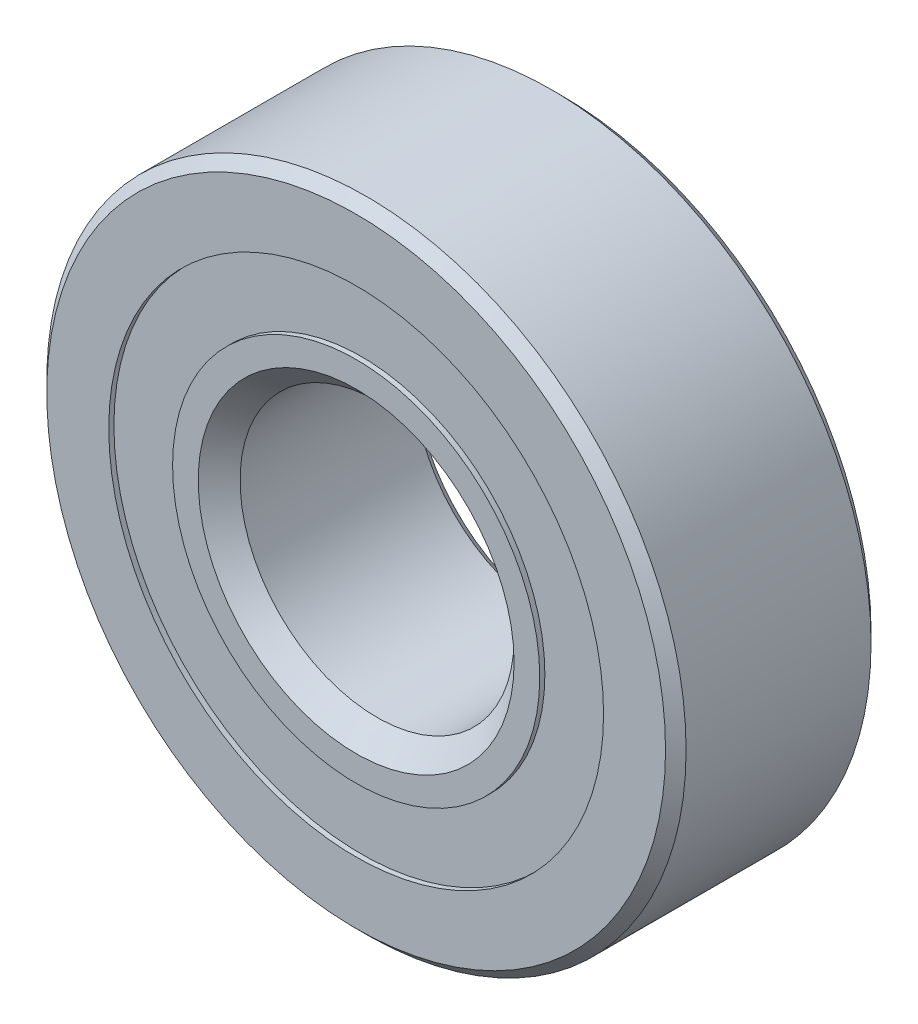
from build123d import *

# Parameters (mm, degrees)
CIRPATTERN1_COUNT = 12
SKETCH5_W         = 1.672929924
SKETCH5_H         = 2.218205964


with BuildPart() as part:
    # Sketch1 → Revolve1 (revolve)
    with BuildSketch(Plane(origin=(0, 0, 0), x_dir=(0, 0, -1), z_dir=(1, 0, 0)), mode=Mode.PRIVATE) as revolve1_sk:
        with BuildLine():
            Line((3.2146875, 11.1125), (-3.2146875, 11.1125))
            Line((-3.2146875, 11.1125), (-3.571875, 10.7553125))
            Line((-3.571875, 10.7553125), (-3.571875, 8.600412088))
            Line((-3.571875, 8.600412088), (-1.5875, 8.600412088))
            ThreePointArc((-1.5875, 8.600412088), (0, 9.657851326), (1.5875, 8.600412088))
            Line((1.5875, 8.600412088), (3.571875, 8.600412088))
            Line((3.571875, 8.600412088), (3.571875, 10.7553125))
            Line((3.571875, 10.7553125), (3.2146875, 11.1125))
        make_face()
    revolve(revolve1_sk.sketch.rotate(Axis((0, 0, 3.571875), (0, 0, -1)), 90), axis=Axis((0, 0, 3.571875), (0, 0, -1)))


with BuildPart() as body_2:
    # Sketch3 → Revolve3 (revolve)
    with BuildSketch(Plane(origin=(0, 0, 0), x_dir=(0, 0, -1), z_dir=(1, 0, 0)), mode=Mode.PRIVATE) as revolve3_sk:
        with BuildLine():
            Line((-3.39328125, 6.203612374), (-2.679493212, 5.489824337))
            Line((-2.679493212, 5.489824337), (0, 5.489824337))
            Line((0, 5.489824337), (0, 6.217148674))
            ThreePointArc((0, 6.217148674), (0.95372087, 6.505709098), (1.5875, 7.274587912))
            Line((1.5875, 7.274587912), (3.571875, 7.274587912))
            Line((3.571875, 7.274587912), (3.571875, 5.1196875))
            Line((3.571875, 5.1196875), (3.2146875, 4.7625))
            Line((3.2146875, 4.7625), (-2.844550663, 4.7625))
            Line((-2.844550663, 4.7625), (-3.571875, 5.489824337))
            Line((-3.571875, 5.489824337), (-3.571875, 6.382206124))
            Line((-3.571875, 6.382206124), (-3.39328125, 6.382206124))
            Line((-3.39328125, 6.382206124), (-3.39328125, 6.203612374))
        make_face()
    revolve(revolve3_sk.sketch.rotate(Axis((0, 0, 3.571875), (0, 0, -1)), 90), axis=Axis((0, 0, 3.571875), (0, 0, -1)))


with BuildPart() as body_3:
    # Sketch4 → Revolve4 (revolve)
    with BuildSketch(Plane(origin=(0, 0, 0), x_dir=(0, 0, -1), z_dir=(1, 0, 0))):
        with BuildLine():
            Line((-1.720351326, 7.9375), (1.720351326, 7.9375))
            ThreePointArc((1.720351326, 7.9375), (0, 9.657851326), (-1.720351326, 7.9375))
        make_face()
    revolve(axis=Axis((0, 7.9375, 1.720351326), (0, 0, -1)))


with BuildPart() as cirpattern1_1:
    # CirPattern1: pattern copy
    add(body_3.part.rotate(Axis((0, 0, 0), (0, 0, 1)), 1 * 360 / CIRPATTERN1_COUNT))


with BuildPart() as cirpattern1_2:
    # CirPattern1: pattern copy
    add(body_3.part.rotate(Axis((0, 0, 0), (0, 0, 1)), 2 * 360 / CIRPATTERN1_COUNT))


with BuildPart() as cirpattern1_3:
    # CirPattern1: pattern copy
    add(body_3.part.rotate(Axis((0, 0, 0), (0, 0, 1)), 3 * 360 / CIRPATTERN1_COUNT))


with BuildPart() as cirpattern1_4:
    # CirPattern1: pattern copy
    add(body_3.part.rotate(Axis((0, 0, 0), (0, 0, 1)), 4 * 360 / CIRPATTERN1_COUNT))


with BuildPart() as cirpattern1_5:
    # CirPattern1: pattern copy
    add(body_3.part.rotate(Axis((0, 0, 0), (0, 0, 1)), 5 * 360 / CIRPATTERN1_COUNT))


with BuildPart() as cirpattern1_6:
    # CirPattern1: pattern copy
    add(body_3.part.rotate(Axis((0, 0, 0), (0, 0, 1)), 6 * 360 / CIRPATTERN1_COUNT))


with BuildPart() as cirpattern1_7:
    # CirPattern1: pattern copy
    add(body_3.part.rotate(Axis((0, 0, 0), (0, 0, 1)), 7 * 360 / CIRPATTERN1_COUNT))


with BuildPart() as cirpattern1_8:
    # CirPattern1: pattern copy
    add(body_3.part.rotate(Axis((0, 0, 0), (0, 0, 1)), 8 * 360 / CIRPATTERN1_COUNT))


with BuildPart() as cirpattern1_9:
    # CirPattern1: pattern copy
    add(body_3.part.rotate(Axis((0, 0, 0), (0, 0, 1)), 9 * 360 / CIRPATTERN1_COUNT))


with BuildPart() as cirpattern1_10:
    # CirPattern1: pattern copy
    add(body_3.part.rotate(Axis((0, 0, 0), (0, 0, 1)), 10 * 360 / CIRPATTERN1_COUNT))


with BuildPart() as cirpattern1_11:
    # CirPattern1: pattern copy
    add(body_3.part.rotate(Axis((0, 0, 0), (0, 0, 1)), 11 * 360 / CIRPATTERN1_COUNT))


with BuildPart() as body_15:
    # Sketch5 → Revolve5 (revolve)
    with BuildSketch(Plane(origin=(0, 0, 0), x_dir=(0, 0, -1), z_dir=(1, 0, 0)), mode=Mode.PRIVATE) as revolve5_sk:
        with Locations((-2.556816288, 7.491309106)):
            Rectangle(SKETCH5_W, SKETCH5_H)
        with Locations((2.556816288, 7.491309106)):
            Rectangle(SKETCH5_W, SKETCH5_H)
    revolve(revolve5_sk.sketch.rotate(Axis((0, 0, 3.571875), (0, 0, -1)), 90), axis=Axis((0, 0, 3.571875), (0, 0, -1)))


solid = Compound([part.part, body_2.part, body_3.part, cirpattern1_1.part, cirpattern1_2.part, cirpattern1_3.part, cirpattern1_4.part, cirpattern1_5.part, cirpattern1_6.part, cirpattern1_7.part, cirpattern1_8.part, cirpattern1_9.part, cirpattern1_10.part, cirpattern1_11.part, body_15.part])
